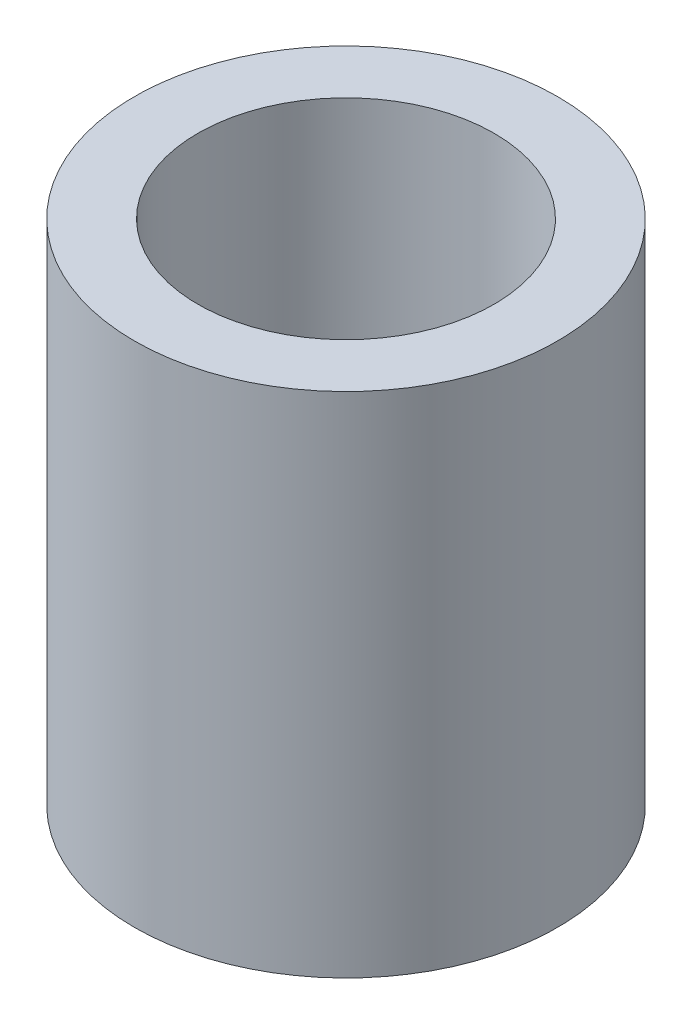
from build123d import *

# Parameters (mm, degrees)
SKETCH1_R           = 7.9375
SKETCH1_R_2         = 5.55625
BOSS_EXTRUDE1_DEPTH = 19.05


with BuildPart() as part:
    # Sketch1 → Boss-Extrude1 (new body)
    with BuildSketch(Plane(origin=(0, 0, 0), x_dir=(1, 0, 0), z_dir=(0, 1, 0))):
        with Locations(Location((0, 0, 0), (0, 0, 90))):
            Circle(SKETCH1_R)
        with Locations(Location((0, 0, 0), (0, 0, 90))):
            Circle(SKETCH1_R_2, mode=Mode.SUBTRACT)
    extrude(amount=BOSS_EXTRUDE1_DEPTH)


solid = part.part
